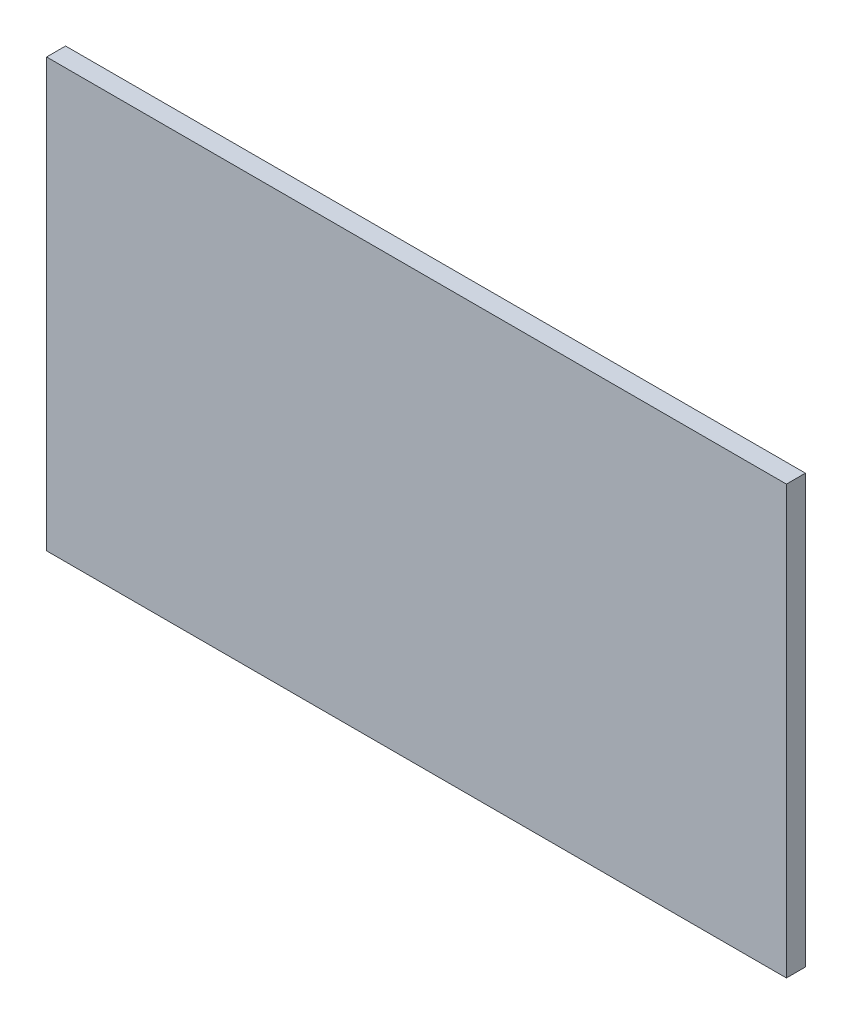
from build123d import *

# Parameters (mm, degrees)
SKETCH1_W           = 296.98
SKETCH1_H           = 171.7
BOSS_EXTRUDE1_DEPTH = 7.62


with BuildPart() as part:
    # Sketch1 → Boss-Extrude1 (new body)
    with BuildSketch(Plane.XY):
        Rectangle(SKETCH1_W, SKETCH1_H)
    extrude(amount=BOSS_EXTRUDE1_DEPTH)


solid = part.part
